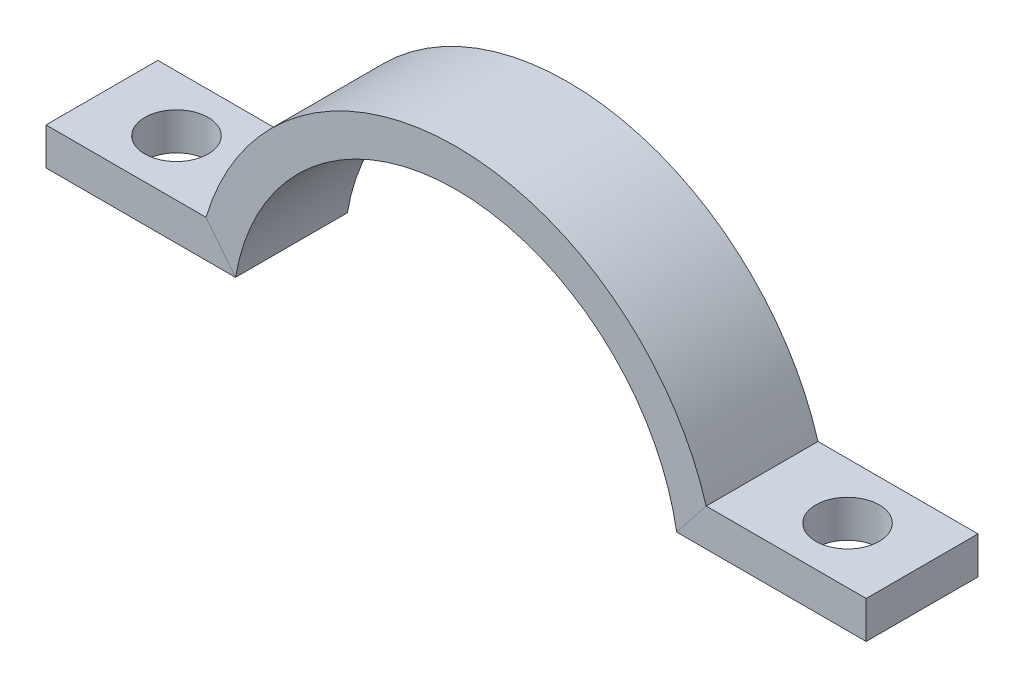
from build123d import *

# Parameters (mm, degrees)
SKETCH_2_W         = 6
SKETCH_2_H         = 2
HOLE_WIZARD_M3_1_D = 3.4


with BuildPart() as part:
    # 掃出1: sweep along a path in 草圖1
    with BuildLine(Plane.XY) as sweep_1_path:
        Line((-22, 2), (-11.832159566, 2))
        ThreePointArc((-11.832159566, 2), (0, 12), (11.832159566, 2))
        Line((11.832159566, 2), (22, 2))
    # 草圖2 → 掃出1 (sweep)
    with BuildSketch(Plane(origin=(22, 0, 0), x_dir=(0, 0, -1), z_dir=(1, 0, 0))):
        with Locations((0, 3)):
            Rectangle(SKETCH_2_W, SKETCH_2_H)
    sweep(path=sweep_1_path.line, transition=Transition.RIGHT)

    # M3 餘隙孔1 (through all)
    with Locations(Plane(origin=(0, 4, 0), x_dir=(1, 0, 0), z_dir=(0, 1, 0))):
        with Locations((-18, 0), (18, 0)):
            Hole(HOLE_WIZARD_M3_1_D / 2)


solid = part.part
